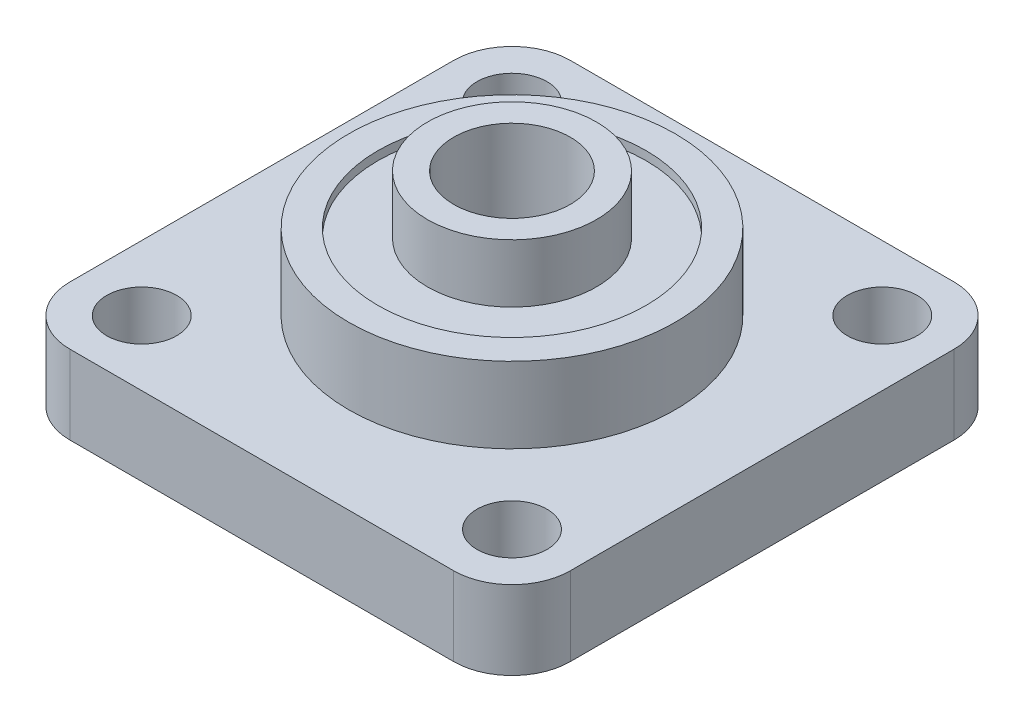
from build123d import *

# Parameters (mm, degrees)
SKETCH_2_W          = 85.8
SKETCH_2_H          = 85.8
SKETCH_2_R          = 6
EXTRUDE_1_DEPTH     = 13.5
FILLET_1_R          = 10
SKETCH_3_R          = 10
CUT_EXTRUDE_1_DEPTH = 65.366683929


with BuildPart() as part:
    # 草图1 → 旋转1 (revolve)
    with BuildSketch(Plane.XY, mode=Mode.PRIVATE) as revolve_1_sk:
        Polygon((10, 30), (14.5, 30), (14.5, 20), (23, 20), (23, 21.5), (28, 21.5), (28, 3.5), (14.5, 3.5), (14.5, 0), (10, 0), align=None)
    revolve(revolve_1_sk.sketch.rotate(Axis((0, 50.942477876, 0), (0, -1, 0)), 90), axis=Axis((0, 50.942477876, 0), (0, -1, 0)))

    # 草图2 → 凸台-拉伸1 (add)
    with BuildSketch(Plane(origin=(0, -5, 0), x_dir=(1, 0, 0), z_dir=(0, 1, 0))):
        Rectangle(SKETCH_2_W, SKETCH_2_H)
        with Locations(Location((-31.75, 31.75, 0), (0, 0, 270))):
            Circle(SKETCH_2_R, mode=Mode.SUBTRACT)
        with Locations(Location((31.75, 31.75, 0), (0, 0, 270))):
            Circle(SKETCH_2_R, mode=Mode.SUBTRACT)
        with Locations(Location((31.75, -31.75, 0), (0, 0, 270))):
            Circle(SKETCH_2_R, mode=Mode.SUBTRACT)
        with Locations(Location((-31.75, -31.75, 0), (0, 0, 270))):
            Circle(SKETCH_2_R, mode=Mode.SUBTRACT)
    extrude(amount=EXTRUDE_1_DEPTH)

    # 圆角1
    fillet_1_edges = [part.edges().sort_by_distance(p)[0] for p in [
        (42.9, 1.75, 42.9),
        (42.9, 1.75, -42.9),
        (-42.9, 1.75, -42.9),
        (-42.9, 1.75, 42.9),
    ]]
    fillet(fillet_1_edges, radius=FILLET_1_R)

    # 草图3 → 切除-拉伸1 (cut, through all)
    with BuildSketch(Plane(origin=(0, 8.5, 0), x_dir=(1, 0, 0), z_dir=(0, 1, 0))):
        with Locations(Location((0, 0, 0), (0, 0, 270))):
            Circle(SKETCH_3_R)
    extrude(amount=-CUT_EXTRUDE_1_DEPTH, mode=Mode.SUBTRACT)


solid = part.part
